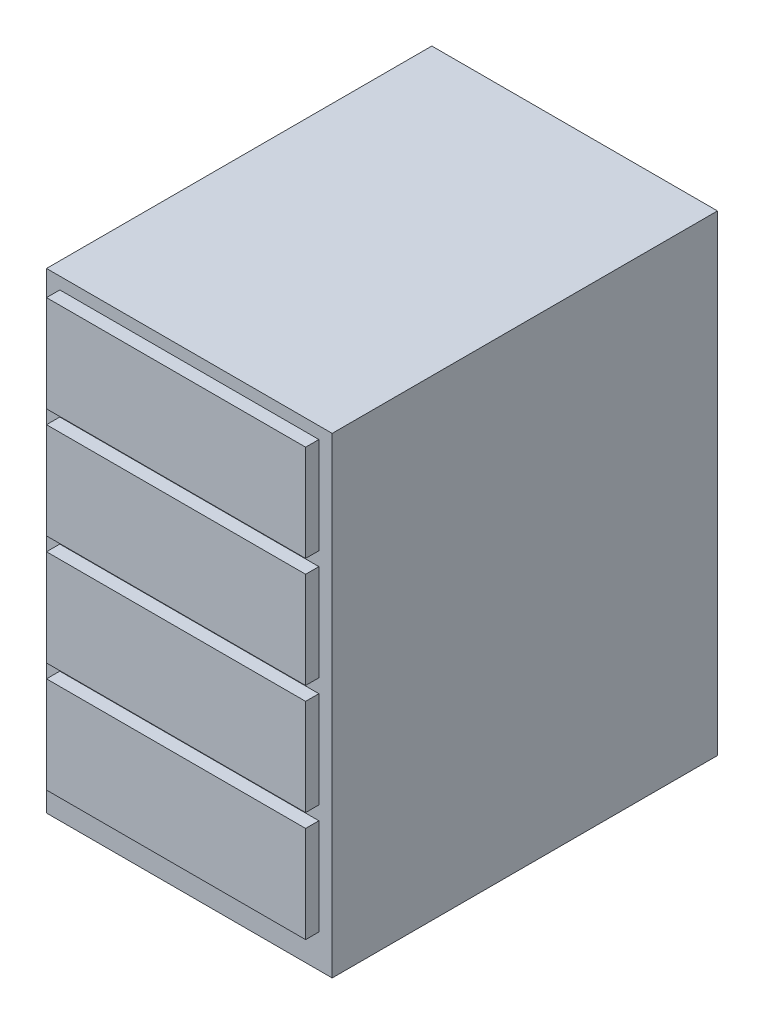
from build123d import *

# Parameters (mm, degrees)
ESQUISSE1_W        = 430
ESQUISSE1_H        = 710
BOSS_EXTRU_1_DEPTH = 580
ESQUISSE2_W        = 390
ESQUISSE2_H        = 145
BOSS_EXTRU_2_DEPTH = 20


with BuildPart() as part:
    # Esquisse1 → Boss.-Extru.1 (new body)
    with BuildSketch(Plane.XY):
        with Locations((215, 355)):
            Rectangle(ESQUISSE1_W, ESQUISSE1_H)
    extrude(amount=BOSS_EXTRU_1_DEPTH)

    # Esquisse2 → Boss.-Extru.2 (add)
    with BuildSketch(Plane.XY.offset(580)):
        with Locations((215, 453.833333333)):
            Rectangle(ESQUISSE2_W, ESQUISSE2_H)
        with Locations((215, 619.5)):
            Rectangle(ESQUISSE2_W, ESQUISSE2_H)
        with Locations((215, 122.5)):
            Rectangle(ESQUISSE2_W, ESQUISSE2_H)
        with Locations((215, 288.166666667)):
            Rectangle(ESQUISSE2_W, ESQUISSE2_H)
    extrude(amount=BOSS_EXTRU_2_DEPTH)


solid = part.part
